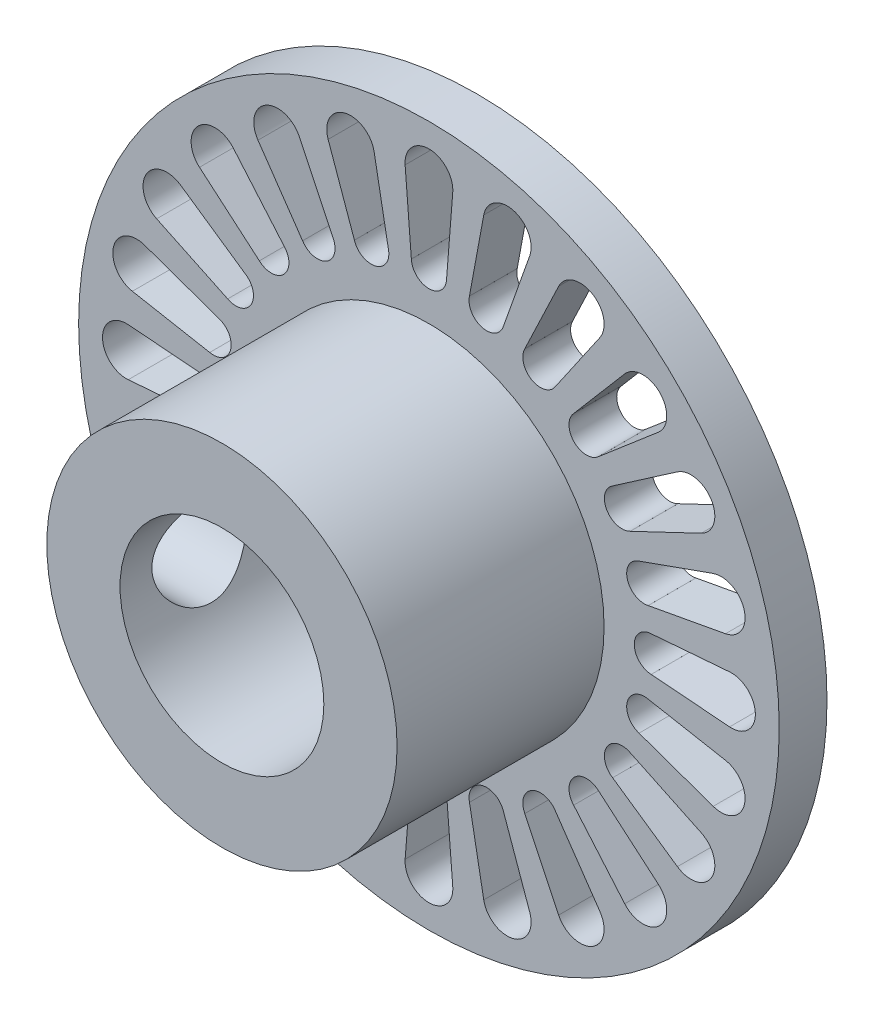
from build123d import *

# Parameters (mm, degrees)
SZKIC1_R                        = 11
DODANIE_WYCI_GNI_CIE1_DEPTH     = 1.5
WYTNIJ_WYCI_GNI_CIE1_DEPTH      = 1.5
SZYK_KO_OWY1_COUNT              = 24
SZKIC4_R                        = 5.5
DODANIE_WYCI_GNI_CIE2_DEPTH     = 6.5
SZKIC6_R                        = 3.2
WYTNIJ_WYCI_GNI_CIE2_DEPTH      = 8
WYTNIJ_WYCI_GNI_CIE3_REACH      = 19.493
WYTNIJ_WYCI_GNI_CIE3_END_RADIUS = 5.5
SZKIC7_R                        = 1.5


with BuildPart() as part:
    # Szkic1 → Dodanie-wyciągnięcie1 (new body)
    with BuildSketch(Plane.XY):
        Circle(SZKIC1_R)
    extrude(amount=DODANIE_WYCI_GNI_CIE1_DEPTH)

    # Szkic3 → Wytnij-wyciągnięcie1 (cut)
    with BuildSketch(Plane.XY.offset(1.5)):
        with BuildLine():
            Line((0.552631579, 6.978151499), (0.747659089, 9.440789474))
            ThreePointArc((0.747659089, 9.440789474), (0, 10.25), (-0.747659089, 9.440789474))
            Line((-0.747659089, 9.440789474), (-0.552631579, 6.978151499))
            ThreePointArc((-0.552631579, 6.978151499), (-0.552416222, 6.97816855), (-0.552200864, 6.978185596))
            ThreePointArc((-0.552200864, 6.978185596), (0, 6.447368421), (0.552200864, 6.978185596))
            ThreePointArc((0.552200864, 6.978185596), (0.552416222, 6.97816855), (0.552631579, 6.978151499))
        make_face()
    wytnij_wyci_gni_cie1 = extrude(amount=-WYTNIJ_WYCI_GNI_CIE1_DEPTH, mode=Mode.SUBTRACT)

    # Szyk kołowy1: Wytnij-wyciągnięcie1 ×24 about axis
    szyk_ko_owy1_axis = Axis((0, 0, 0), (0, 0, 1))
    for i in range(1, SZYK_KO_OWY1_COUNT):
        add(wytnij_wyci_gni_cie1.rotate(szyk_ko_owy1_axis, i * 360 / SZYK_KO_OWY1_COUNT), mode=Mode.SUBTRACT)

    # Szkic4 → Dodanie-wyciągnięcie2 (add)
    with BuildSketch(Plane.XY.offset(1.5)):
        Circle(SZKIC4_R)
    extrude(amount=DODANIE_WYCI_GNI_CIE2_DEPTH)

    # Szkic6 → Wytnij-wyciągnięcie2 (cut)
    with BuildSketch(Plane.XY.offset(8)):
        Circle(SZKIC6_R)
    extrude(amount=-WYTNIJ_WYCI_GNI_CIE2_DEPTH, mode=Mode.SUBTRACT)

    # Wytnij-wyciągnięcie3: up to this cylinder (the profile starts inside it)
    wytnij_wyci_gni_cie3_end = Plane(origin=(0, 0, 5.5), z_dir=(0, 0, -1)) * Cylinder(WYTNIJ_WYCI_GNI_CIE3_END_RADIUS, 50.986, mode=Mode.PRIVATE)
    # Szkic7 → Wytnij-wyciągnięcie3 (cut, up to the surface)
    with BuildSketch(Plane(origin=(0, 0, 0), x_dir=(0, 0, -1), z_dir=(1, 0, 0)), mode=Mode.PRIVATE) as wytnij_wyci_gni_cie3_sk1:
        with Locations((-5.5, 0)):
            Circle(SZKIC7_R)
    wytnij_wyci_gni_cie3_tool1 = extrude(wytnij_wyci_gni_cie3_sk1.sketch, amount=-WYTNIJ_WYCI_GNI_CIE3_REACH, mode=Mode.PRIVATE) & wytnij_wyci_gni_cie3_end
    add(wytnij_wyci_gni_cie3_tool1.solids().sort_by_distance((0, 0, 5.5))[0], mode=Mode.SUBTRACT)


solid = part.part
